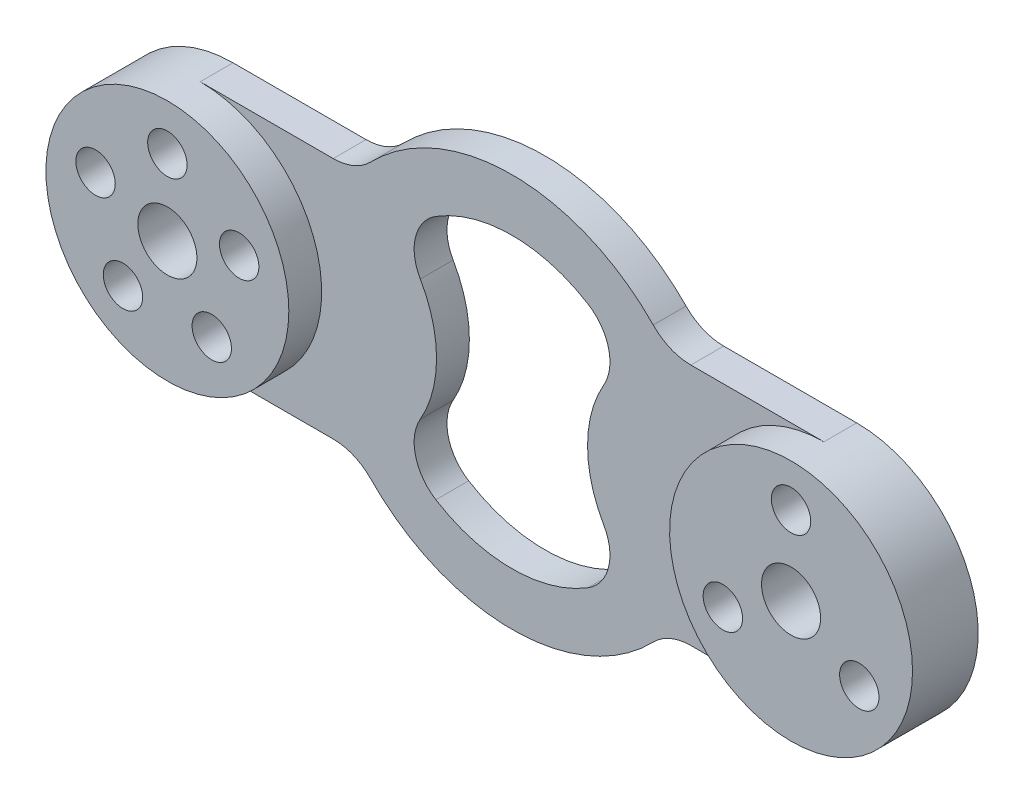
from build123d import *

# Parameters (mm, degrees)
EXTRUDE_1_DEPTH = 10
SKETCH_1_3_R    = 37
SKETCH_1_3_R_2  = 6
SKETCH_1_3_R_3  = 9
EXTRUDE_2_DEPTH = 20


with BuildPart() as part:
    # Эскиз1 → Бобышка-Вытянуть1 (new body)
    with BuildSketch(Plane.XY):
        with BuildLine():
            Line((-54.470175326, 37), (-95, 37))
            ThreePointArc((-95, 37), (-68.837049096, 26.162950904), (-58, 0))
            ThreePointArc((-58, 0), (-68.837049096, -26.162950904), (-95, -37))
            Line((-95, -37), (-54.470175326, -37))
            ThreePointArc((-54.470175326, -37), (-48.246282484, -38.260150683), (-43.002769994, -41.842105263))
            ThreePointArc((-43.002769994, -41.842105263), (0, -60), (43.002769994, -41.842105263))
            ThreePointArc((43.002769994, -41.842105263), (48.246282484, -38.260150683), (54.470175326, -37))
            Line((54.470175326, -37), (95, -37))
            ThreePointArc((95, -37), (58, 0), (95, 37))
            Line((95, 37), (54.470175326, 37))
            ThreePointArc((54.470175326, 37), (48.246282484, 38.260150683), (43.002769994, 41.842105263))
            ThreePointArc((43.002769994, 41.842105263), (0, 60), (-43.002769994, 41.842105263))
            ThreePointArc((-43.002769994, 41.842105263), (-48.246282484, 38.260150683), (-54.470175326, 37))
        make_face()
        with BuildLine():
            ThreePointArc((-23.21, 37.380421346), (0, 44), (23.21, 37.380421346))
            ThreePointArc((23.21, 37.380421346), (29.403784815, 28.894964715), (27.951470588, 18.490315372))
            ThreePointArc((27.951470588, 18.490315372), (23, 0), (27.951470588, -18.490315372))
            ThreePointArc((27.951470588, -18.490315372), (29.403784815, -28.894964715), (23.21, -37.380421346))
            ThreePointArc((23.21, -37.380421346), (0, -44), (-23.21, -37.380421346))
            ThreePointArc((-23.21, -37.380421346), (-29.403784815, -28.894964715), (-27.951470588, -18.490315372))
            ThreePointArc((-27.951470588, -18.490315372), (-23, 0), (-27.951470588, 18.490315372))
            ThreePointArc((-27.951470588, 18.490315372), (-29.403784815, 28.894964715), (-23.21, 37.380421346))
        make_face(mode=Mode.SUBTRACT)
    extrude(amount=EXTRUDE_1_DEPTH)

    # Эскиз1<3> → Бобышка-Вытянуть2 (add)
    # profile 1 of 2: a face of its own
    with BuildSketch(Plane.XY):
        with Locations((-95, 0)):
            Circle(SKETCH_1_3_R)
        with Locations((-73.125700125, 7.107390871)):
            Circle(SKETCH_1_3_R_2, mode=Mode.SUBTRACT)
        with Locations((-95, 23)):
            Circle(SKETCH_1_3_R_2, mode=Mode.SUBTRACT)
        with Locations((-116.874299875, 7.107390871)):
            Circle(SKETCH_1_3_R_2, mode=Mode.SUBTRACT)
        with Locations((-108.519060803, -18.607390871)):
            Circle(SKETCH_1_3_R_2, mode=Mode.SUBTRACT)
        with Locations((-81.480939197, -18.607390871)):
            Circle(SKETCH_1_3_R_2, mode=Mode.SUBTRACT)
        with Locations((-95, 0)):
            Circle(SKETCH_1_3_R_3, mode=Mode.SUBTRACT)
    # profile 2 of 2: a face of its own
    with BuildSketch(Plane.XY):
        with Locations((95, 0)):
            Circle(SKETCH_1_3_R)
        with Locations((95, 24)):
            Circle(SKETCH_1_3_R_2, mode=Mode.SUBTRACT)
        with Locations((74.215390309, -12)):
            Circle(SKETCH_1_3_R_2, mode=Mode.SUBTRACT)
        with Locations((115.784609691, -12)):
            Circle(SKETCH_1_3_R_2, mode=Mode.SUBTRACT)
        with Locations((95, 0)):
            Circle(SKETCH_1_3_R_3, mode=Mode.SUBTRACT)
    extrude(amount=EXTRUDE_2_DEPTH)


solid = part.part
